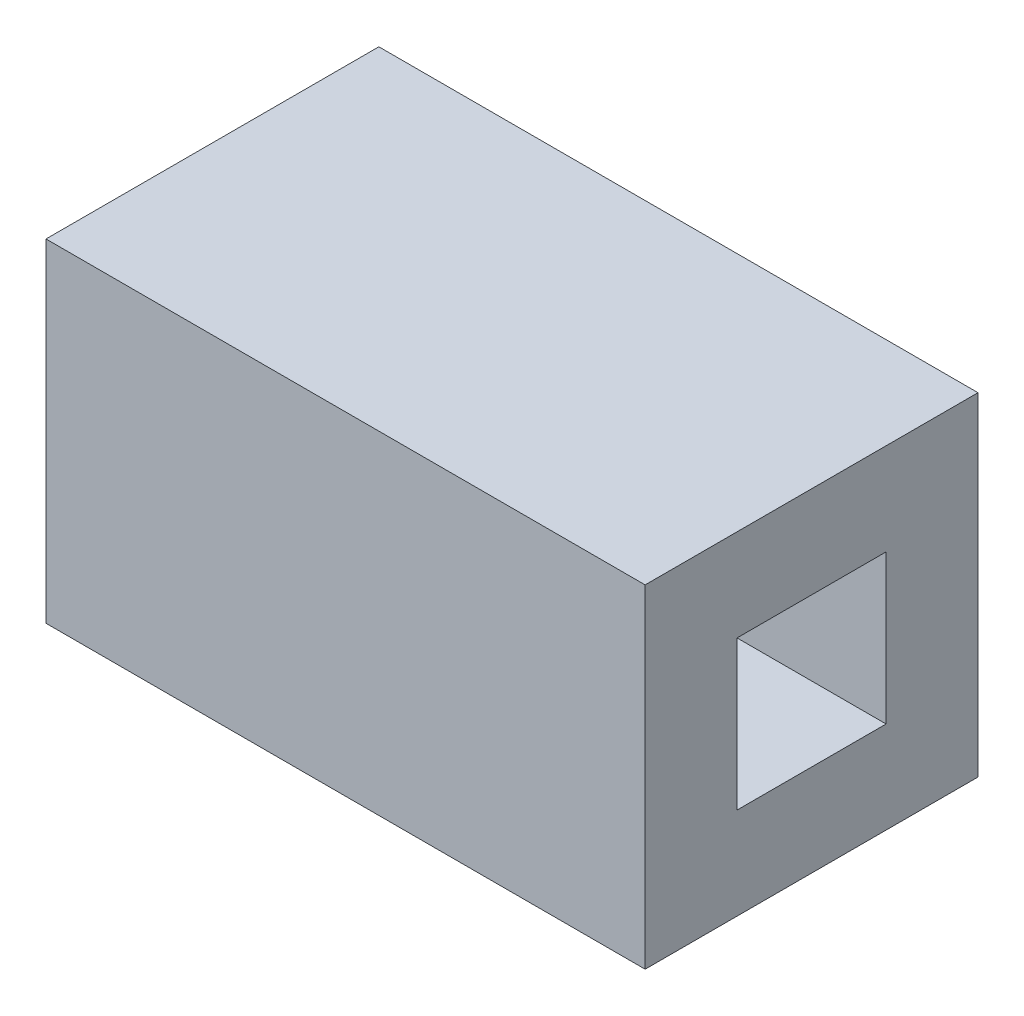
from build123d import *

# Parameters (mm, degrees)
CROQUIS1_W              = 7.5
CROQUIS1_H              = 7.5
SALIENTE_EXTRUIR1_DEPTH = 7
CROQUIS1_3_W            = 7.5
CROQUIS1_3_H            = 7.5
CROQUIS1_3_W_2          = 3.35875721
CROQUIS1_3_H_2          = 3.35875721
SALIENTE_EXTRUIR2_DEPTH = 6.5


with BuildPart() as part:
    # Croquis1 → Saliente-Extruir1 (new body)
    with BuildSketch(Plane.YZ):
        Rectangle(CROQUIS1_W, CROQUIS1_H)
    extrude(amount=-SALIENTE_EXTRUIR1_DEPTH)

    # Croquis1<3> → Saliente-Extruir2 (add)
    with BuildSketch(Plane.YZ):
        Rectangle(CROQUIS1_3_W, CROQUIS1_3_H)
        Rectangle(CROQUIS1_3_W_2, CROQUIS1_3_H_2, mode=Mode.SUBTRACT)
    extrude(amount=SALIENTE_EXTRUIR2_DEPTH)


solid = part.part
